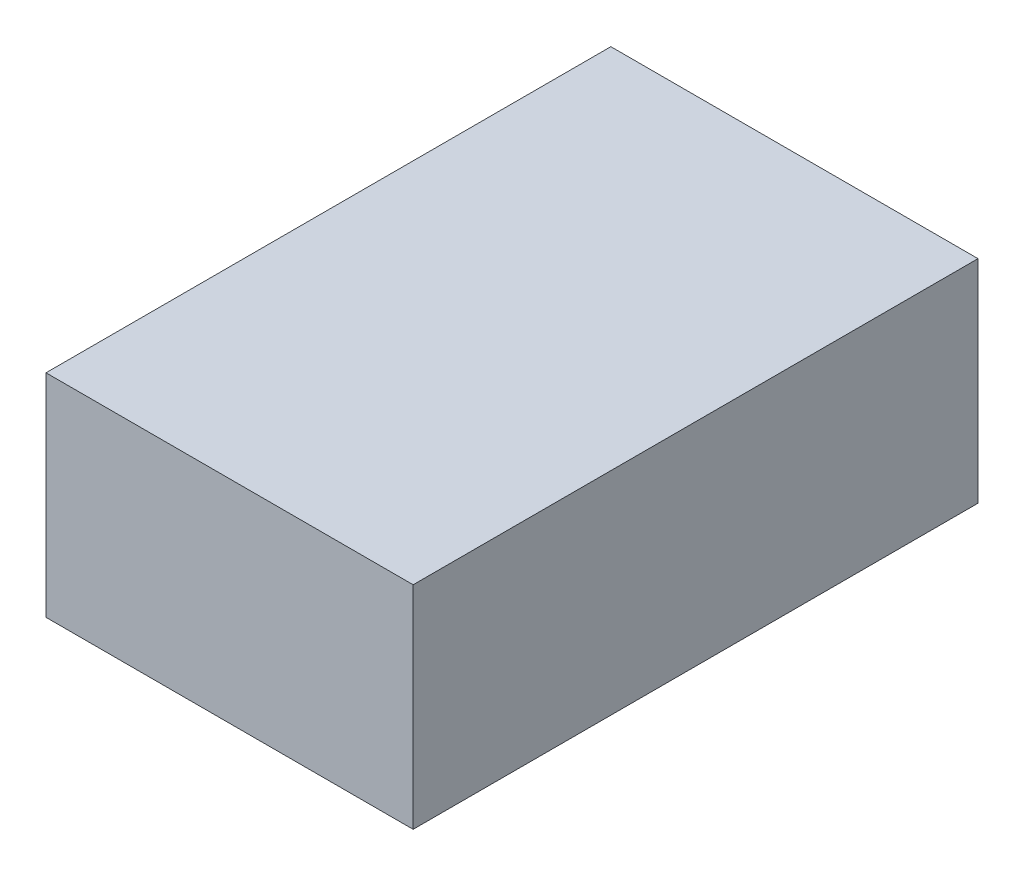
from build123d import *

# Parameters (mm, degrees)
SKETCH_1_W      = 2.6
SKETCH_1_H      = 4
EXTRUDE_1_DEPTH = 1.5


with BuildPart() as part:
    # 草图1 → 凸台-拉伸1 (new body)
    with BuildSketch(Plane(origin=(0, 0, 0), x_dir=(1, 0, 0), z_dir=(0, 1, 0))):
        with Locations((-16.398107118, -20.341669877)):
            Rectangle(SKETCH_1_W, SKETCH_1_H)
    extrude(amount=EXTRUDE_1_DEPTH)


solid = part.part
